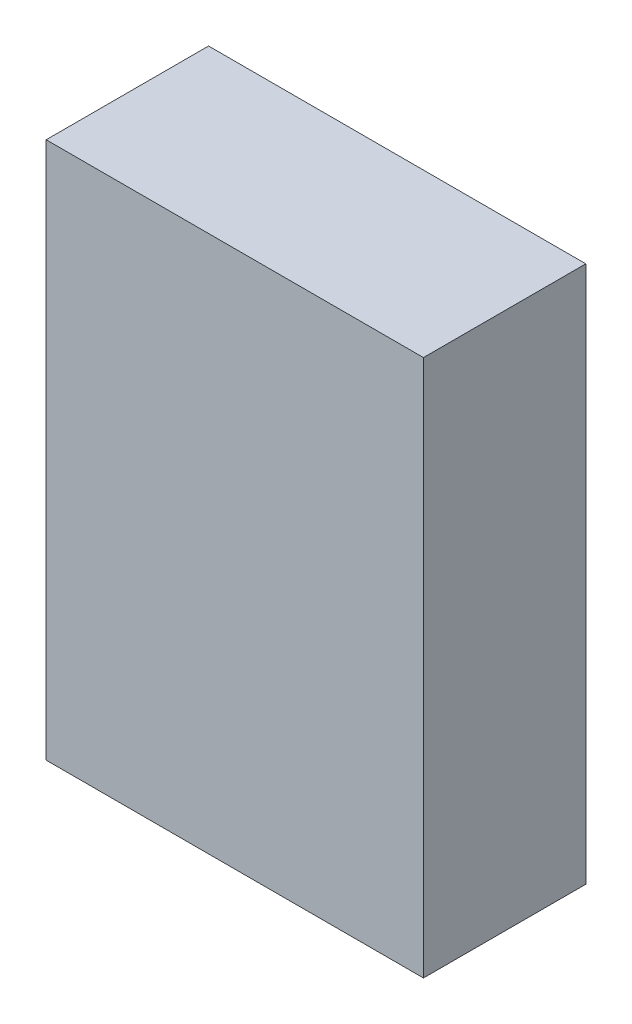
from build123d import *

# Parameters (mm, degrees)
SKETCH3_R           = 3.739985504
BOSS_EXTRUDE1_DEPTH = 2
SKETCH4_W           = 20.9095389
SKETCH4_H           = 29.780418306
BOSS_EXTRUDE2_DEPTH = 7


with BuildPart() as part:
    # Sketch3 → Boss-Extrude1 (new body)
    with BuildSketch(Plane.XY):
        with BuildLine():
            Line((-60.167323843, -17.670722848), (-60.167323843, -27.522824769))
            Line((-60.167323843, -27.522824769), (-39.257784943, -27.522824769))
            Line((-39.257784943, -27.522824769), (-39.257784943, 2.257593537))
            Line((-39.257784943, 2.257593537), (-60.167323843, 2.257593537))
            Line((-60.167323843, 2.257593537), (-60.167323843, -7.594508384))
            ThreePointArc((-60.167323843, -7.594508384), (-65.205431076, -12.632615616), (-60.167323843, -17.670722848))
        make_face()
        with Locations((-60.167323843, -12.632615616)):
            Circle(SKETCH3_R, mode=Mode.SUBTRACT)
    extrude(amount=BOSS_EXTRUDE1_DEPTH)

    # Sketch4 → Boss-Extrude2 (add)
    with BuildSketch(Plane.XY.offset(2)):
        with Locations((-49.712554393, -12.632615616)):
            Rectangle(SKETCH4_W, SKETCH4_H)
    extrude(amount=BOSS_EXTRUDE2_DEPTH)


solid = part.part
